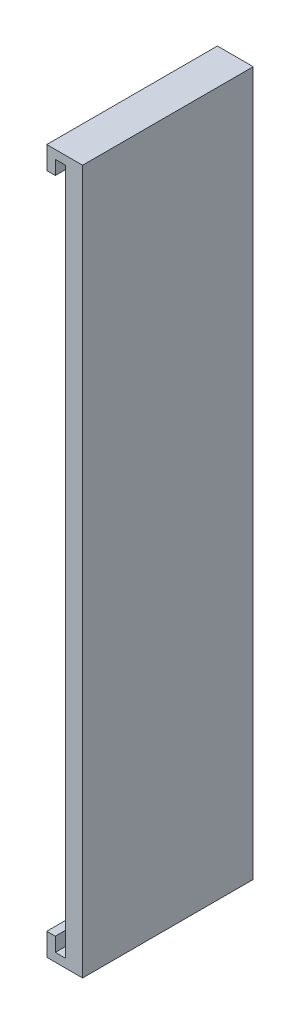
from build123d import *

# Parameters (mm, degrees)
BOSS_EXTRUDE1_DEPTH = 20


with BuildPart() as part:
    # Sketch1 → Boss-Extrude1 (new body)
    with BuildSketch(Plane(origin=(0, 0, 0), x_dir=(0, 1, 0), z_dir=(0, 0, 1))):
        Polygon((-38.603475532, 1.6), (-41.25, 1.6), (-41.25, -2.6), (41.25, -2.6), (41.25, 1.6), (38.603475532, 1.6), (38.603475532, 0.6), (40.25, 0.6), (40.25, -0.6), (-38.603475532, -0.6), (-40.25, -0.6), (-40.25, 0.6), (-38.603475532, 0.6), align=None)
    extrude(amount=BOSS_EXTRUDE1_DEPTH)


solid = part.part
